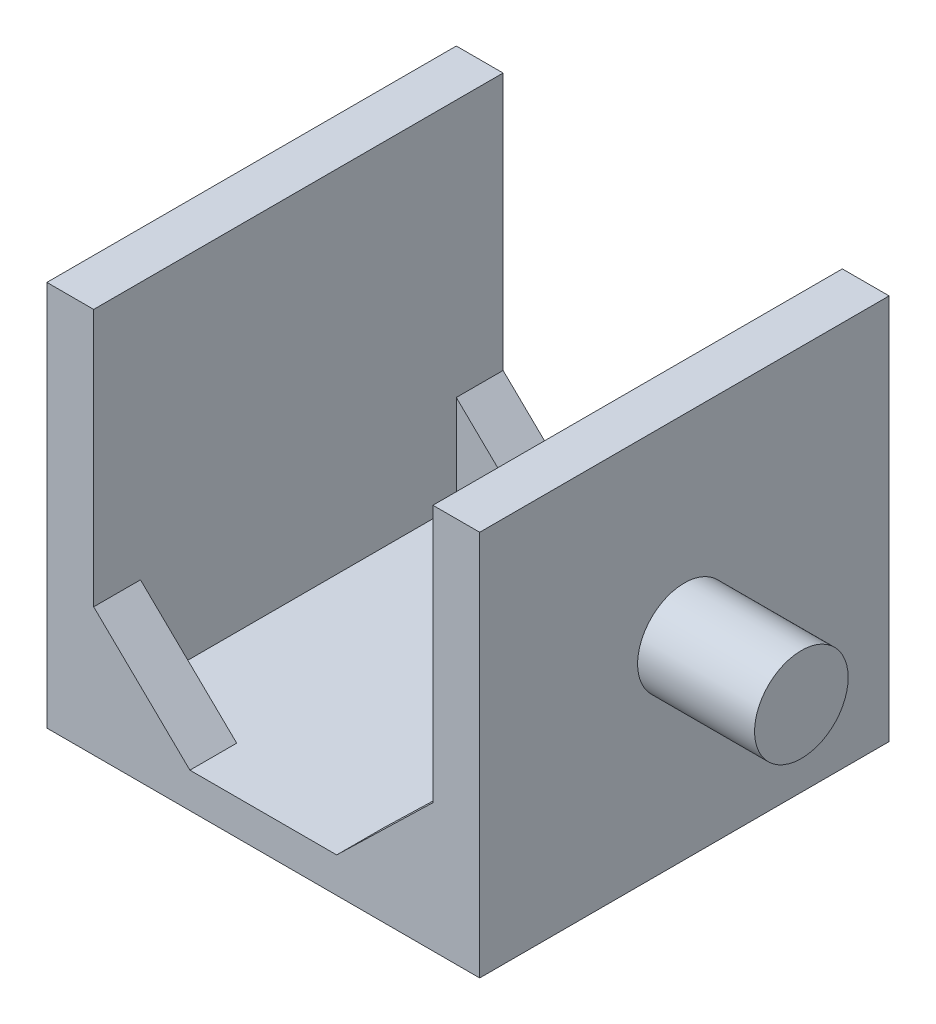
from build123d import *

# Parameters (mm, degrees)
SKETCH1_W            = 37
SKETCH1_H            = 35
SKETCH1_R            = 2
BOSS_EXTRUDE1_DEPTH  = 3
SKETCH2_W            = 4
SKETCH2_H            = 35
BOSS_EXTRUDE2_DEPTH  = 30
SKETCH3_R            = 4
BOSS_EXTRUDE3_DEPTH  = 8
BOSS_EXTRUDE4_START  = 10
SKETCH4_R            = 4
BOSS_EXTRUDE4_DEPTH  = 10
BOSS_EXTRUDE5_DEPTH  = 4
MIRROR2_COPY_1_DEPTH = 4


with BuildPart() as part:
    # Sketch1 → Boss-Extrude1 (new body)
    with BuildSketch(Plane(origin=(0, 0, 0), x_dir=(1, 0, 0), z_dir=(0, 1, 0))):
        Rectangle(SKETCH1_W, SKETCH1_H)
        with Locations(Location((0, 0, 0), (0, 0, 270))):
            Circle(SKETCH1_R, mode=Mode.SUBTRACT)
    extrude(amount=BOSS_EXTRUDE1_DEPTH)

    # Sketch2 → Boss-Extrude2 (add)
    with BuildSketch(Plane(origin=(0, 3, 0), x_dir=(1, 0, 0), z_dir=(0, 1, 0))):
        with Locations((-16.5, 0)):
            Rectangle(SKETCH2_W, SKETCH2_H)
        with Locations((16.5, 0)):
            Rectangle(SKETCH2_W, SKETCH2_H)
    extrude(amount=BOSS_EXTRUDE2_DEPTH)

    # Sketch3 → Boss-Extrude3 (add)
    with BuildSketch(Plane.ZY.offset(18.5)):
        with Locations((0, 16.5)):
            Circle(SKETCH3_R)
    extrude(amount=BOSS_EXTRUDE3_DEPTH)

    # Sketch4 → Boss-Extrude4 (add)
    with BuildSketch(Plane(origin=(18.5, 0, 0), x_dir=(0, 0, -1), z_dir=(1, 0, 0)).offset(BOSS_EXTRUDE4_START)):
        with Locations(Location((0, 16.5, 0), (0, 0, 180))):
            Circle(SKETCH4_R)
    extrude(amount=-BOSS_EXTRUDE4_DEPTH)

    # Sketch5 → Boss-Extrude5 (add)
    with BuildSketch(Plane.XY.offset(17.5)):
        Polygon((-14.5, 10.979110478), (-6.272927794, 3), (-14.5, 3), align=None)
    boss_extrude5 = extrude(amount=-BOSS_EXTRUDE5_DEPTH)

    # Mirror1: Boss-Extrude5 across plane
    add(boss_extrude5.mirror(Plane(origin=(0, 0, 0), x_dir=(0, 0, 1), z_dir=(1, 0, 0))))

    # Mirror2: Boss-Extrude5 across plane
    add(boss_extrude5.mirror(Plane.XY))

    # Mirror2 copy 1 sketch → Mirror2 copy 1 (add)
    with BuildSketch(Plane(origin=(0, 0, -17.5), x_dir=(-1, 0, 0), z_dir=(0, 0, -1))):
        Polygon((-14.5, 10.979110478), (-6.272927794, 3), (-14.5, 3), align=None)
    extrude(amount=-MIRROR2_COPY_1_DEPTH)


solid = part.part
